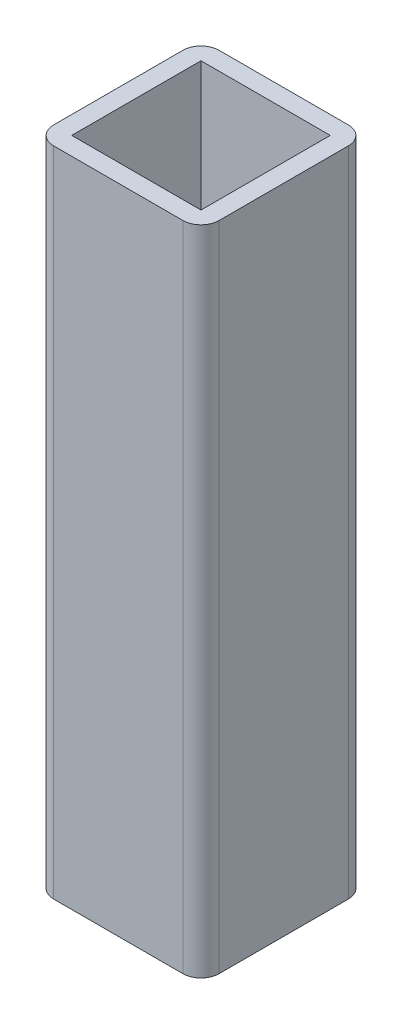
from build123d import *

# Parameters (mm, degrees)
BOSS_EXTRUDE1_DEPTH = 100.91
SKETCH3_W           = 20
SKETCH3_H           = 20
CUT_EXTRUDE1_DEPTH  = 1040.5


with BuildPart() as part:
    # Sketch1 → Boss-Extrude1 (new body)
    with BuildSketch(Plane(origin=(0, 0, 0), x_dir=(1, 0, 0), z_dir=(0, 1, 0))):
        with BuildLine():
            Line((2.8, 0), (22.8, 0))
            ThreePointArc((22.8, 0), (24.779898987, -0.820101013), (25.6, -2.8))
            Line((25.6, -2.8), (25.6, -22.8))
            ThreePointArc((25.6, -22.8), (24.779898987, -24.779898987), (22.8, -25.6))
            Line((22.8, -25.6), (2.8, -25.6))
            ThreePointArc((2.8, -25.6), (0.820101013, -24.779898987), (0, -22.8))
            Line((0, -22.8), (0, -2.8))
            ThreePointArc((0, -2.8), (0.820101013, -0.820101013), (2.8, 0))
        make_face()
    extrude(amount=BOSS_EXTRUDE1_DEPTH)

    # Sketch3 → Cut-Extrude1 (cut)
    with BuildSketch(Plane(origin=(0, 0, 0), x_dir=(-1, 0, 0), z_dir=(0, -1, 0))):
        with Locations((-12.8, -12.8)):
            Rectangle(SKETCH3_W, SKETCH3_H)
    extrude(amount=-CUT_EXTRUDE1_DEPTH, mode=Mode.SUBTRACT)


solid = part.part
